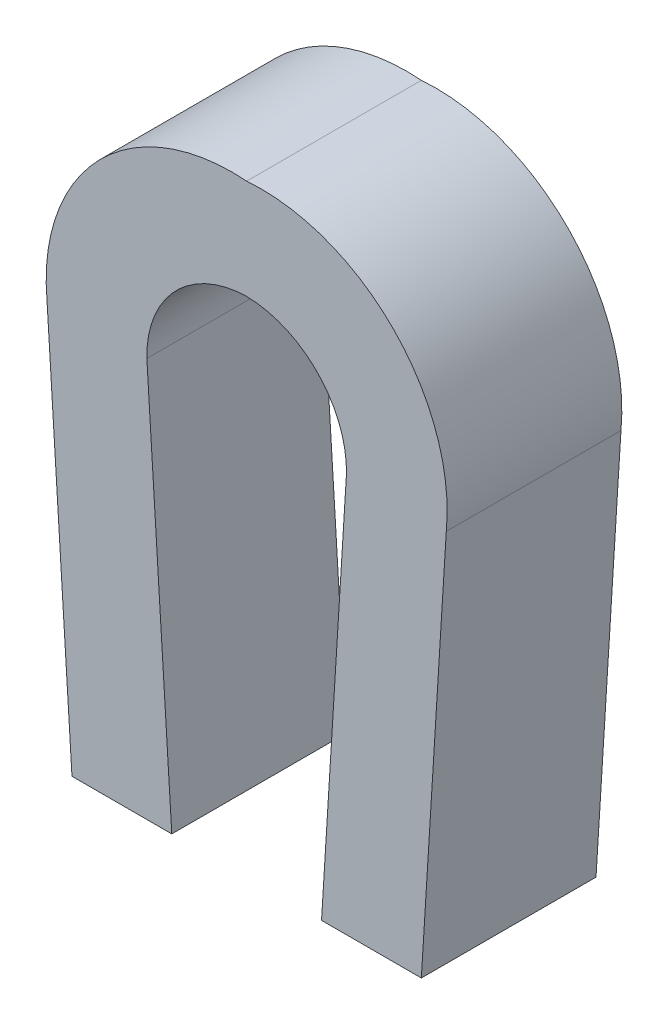
from build123d import *

# Parameters (mm, degrees)
BOSS_EXTRUDE1_DEPTH = 3.5


with BuildPart() as part:
    # Sketch1 → Boss-Extrude1 (new body)
    with BuildSketch(Plane.XY):
        with BuildLine():
            Line((-2, 4), (-1.5, -4))
            Line((-1.5, -4), (-3.5, -4))
            Line((-3.5, -4), (-4, 4))
            ThreePointArc((-4, 4), (-2.950434096, 6.97104187), (0, 8.077214108))
            ThreePointArc((0, 8.077214108), (2.950434096, 6.97104187), (4, 4))
            Line((4, 4), (3.5, -4))
            Line((3.5, -4), (1.5, -4))
            Line((1.5, -4), (2, 4))
            ThreePointArc((2, 4), (1.430965913, 5.453553122), (0, 6.077214108))
            ThreePointArc((0, 6.077214108), (-1.430965913, 5.453553122), (-2, 4))
        make_face()
    extrude(amount=BOSS_EXTRUDE1_DEPTH)


solid = part.part
